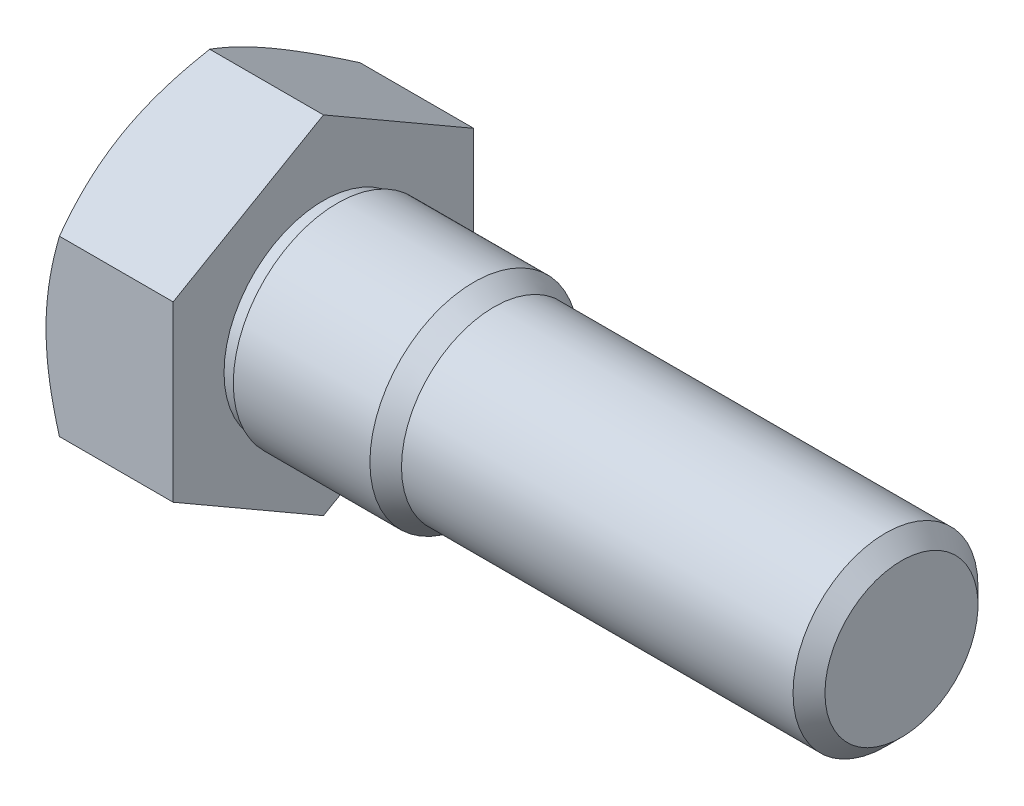
from build123d import *

# Parameters (mm, degrees)
BASEHEAD_DEPTH = 5.5


with BuildPart() as part:
    # BaseHeadSke → BaseHead (new body)
    with BuildSketch(Plane(origin=(0, 0, 0), x_dir=(0, 0, -1), z_dir=(1, 0, 0))):
        Polygon((0, 7.505553499), (-6.5, 3.75277675), (-6.5, -3.75277675), (0, -7.505553499), (6.5, -3.75277675), (6.5, 3.75277675), align=None)
    extrude(amount=BASEHEAD_DEPTH)

    # HeadChamferSke → HeadChamfer (revolve, cut)
    with BuildSketch(Plane.XY):
        Polygon((0, 7.505553499), (0, 6.5), (0.580556584, 7.505553499), align=None)
    revolve(axis=Axis((0, 0, 0), (1, 0, 0)), mode=Mode.SUBTRACT)

    # BodySke → BaseBody (revolve)
    with BuildSketch(Plane.XY, mode=Mode.PRIVATE) as basebody_sk:
        Polygon((5.5, 4.3), (6.1, 4.3), (6.1, 4.5), (12.008974596, 4.5), (12.875, 4), (29.8095, 4), (30.5, 3.3095), (30.5, 0), (5.5, 0), align=None)
    revolve(basebody_sk.sketch.rotate(Axis((0, 0, 0), (1, 0, 0)), 90), axis=Axis((0, 0, 0), (1, 0, 0)))


solid = part.part
